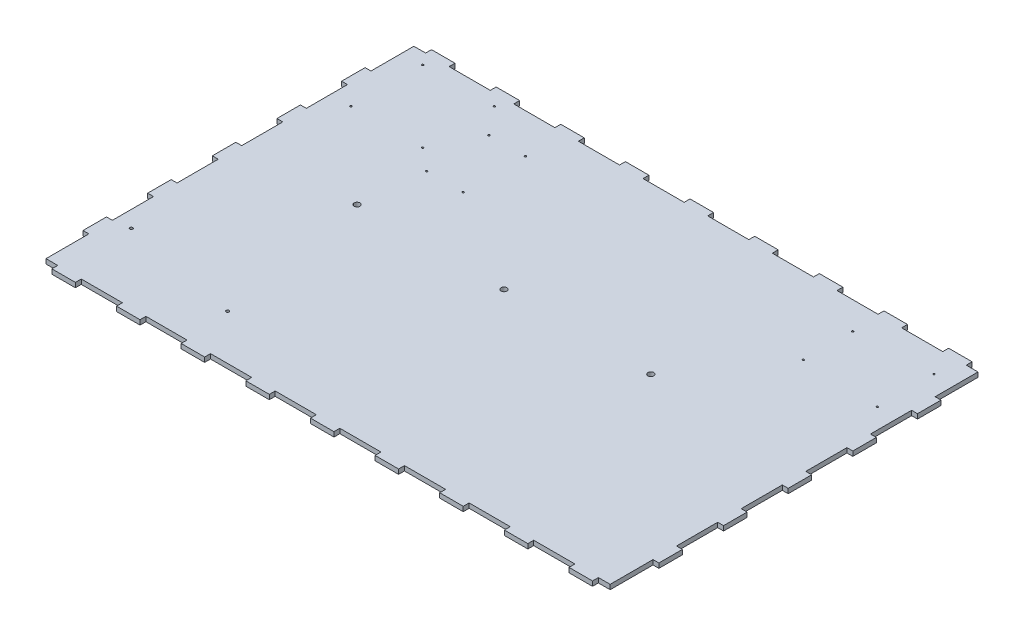
from build123d import *

# Parameters (mm, degrees)
SKETCH1_W                        = 480
SKETCH1_H                        = 313
BASE_DEPTH                       = 4
SKETCH2_W                        = 20
SKETCH2_H                        = 5
TOP_TABS_DEFINITION_DEPTH        = 4
TOP_TABS_PATTERN_COUNT           = 5
TOP_TABS_PATTERN_PITCH           = 55
TOP_TABS_PATTERN_COL_COUNT       = 5
TOP_TABS_PATTERN_COL_PITCH       = 55
BOTTOM_TABS_COPY_1_SKETCH_W      = 20
BOTTOM_TABS_COPY_1_SKETCH_H      = 5
BOTTOM_TABS_COPY_1_DEPTH         = 4
BOTTOM_TABS_COPY_2_SKETCH_W      = 20
BOTTOM_TABS_COPY_2_SKETCH_H      = 5
BOTTOM_TABS_COPY_2_DEPTH         = 4
BOTTOM_TABS_COPY_3_SKETCH_W      = 20
BOTTOM_TABS_COPY_3_SKETCH_H      = 5
BOTTOM_TABS_COPY_3_DEPTH         = 4
BOTTOM_TABS_COPY_4_SKETCH_W      = 20
BOTTOM_TABS_COPY_4_SKETCH_H      = 5
BOTTOM_TABS_COPY_4_DEPTH         = 4
BOTTOM_TABS_COPY_5_SKETCH_W      = 20
BOTTOM_TABS_COPY_5_SKETCH_H      = 5
BOTTOM_TABS_COPY_5_DEPTH         = 4
BOTTOM_TABS_COPY_6_SKETCH_W      = 20
BOTTOM_TABS_COPY_6_SKETCH_H      = 5
BOTTOM_TABS_COPY_6_DEPTH         = 4
BOTTOM_TABS_COPY_7_SKETCH_W      = 20
BOTTOM_TABS_COPY_7_SKETCH_H      = 5
BOTTOM_TABS_COPY_7_DEPTH         = 4
BOTTOM_TABS_COPY_8_SKETCH_W      = 20
BOTTOM_TABS_COPY_8_SKETCH_H      = 5
BOTTOM_TABS_COPY_8_DEPTH         = 4
ELECTRONICS_MOUNTING_HOLES_1_5_D = 1.5
SKETCH7_W                        = 5
SKETCH7_H                        = 20
LEFT_TABS_DEFINITION_DEPTH       = 4
LEFT_TABS_PATTERN_COUNT          = 3
LEFT_TABS_PATTERN_PITCH          = 55
LEFT_TABS_PATTERN_COL_COUNT      = 3
LEFT_TABS_PATTERN_COL_PITCH      = 55
RIGHT_TABS_COPY_1_SKETCH_W       = 5
RIGHT_TABS_COPY_1_SKETCH_H       = 20
RIGHT_TABS_COPY_1_DEPTH          = 4
RIGHT_TABS_COPY_2_SKETCH_W       = 5
RIGHT_TABS_COPY_2_SKETCH_H       = 20
RIGHT_TABS_COPY_2_DEPTH          = 4
RIGHT_TABS_COPY_3_SKETCH_W       = 5
RIGHT_TABS_COPY_3_SKETCH_H       = 20
RIGHT_TABS_COPY_3_DEPTH          = 4
RIGHT_TABS_COPY_4_SKETCH_W       = 5
RIGHT_TABS_COPY_4_SKETCH_H       = 20
RIGHT_TABS_COPY_4_DEPTH          = 4
M6_CLEARANCE_HOLE1_D             = 5
TAP_DRILL_FOR_M3X0_5_TAP1_D      = 2.5


with BuildPart() as part:
    # Sketch1 → Base (new body)
    with BuildSketch(Plane(origin=(0, 0, 0), x_dir=(1, 0, 0), z_dir=(0, 1, 0))):
        Rectangle(SKETCH1_W, SKETCH1_H)
    extrude(amount=BASE_DEPTH)

    # Sketch2 → Top Tabs Definition (add)
    with BuildSketch(Plane(origin=(0, 4, 0), x_dir=(1, 0, 0), z_dir=(0, 1, 0))):
        with Locations((0, 159)):
            Rectangle(SKETCH2_W, SKETCH2_H)
    top_tabs_definition = extrude(amount=-TOP_TABS_DEFINITION_DEPTH)

    # Top Tabs Pattern: Top Tabs Definition ×5
    with Locations(*[(-i * TOP_TABS_PATTERN_PITCH, 0, 0) for i in range(1, TOP_TABS_PATTERN_COUNT)]):
        add(top_tabs_definition)

    # Top Tabs Pattern col: Top Tabs Definition ×5
    with Locations(*[(i * TOP_TABS_PATTERN_COL_PITCH, 0, 0) for i in range(1, TOP_TABS_PATTERN_COL_COUNT)]):
        add(top_tabs_definition)

    # Bottom Tabs: Top Tabs Definition across plane
    add(top_tabs_definition.mirror(Plane.XY))

    # Bottom Tabs copy 1 sketch → Bottom Tabs copy 1 (add)
    with BuildSketch(Plane(origin=(-55, 4, 0), x_dir=(1, 0, 0), z_dir=(0, 1, 0))):
        with Locations((0, -159)):
            Rectangle(BOTTOM_TABS_COPY_1_SKETCH_W, BOTTOM_TABS_COPY_1_SKETCH_H)
    extrude(amount=-BOTTOM_TABS_COPY_1_DEPTH)

    # Bottom Tabs copy 2 sketch → Bottom Tabs copy 2 (add)
    with BuildSketch(Plane(origin=(-110, 4, 0), x_dir=(1, 0, 0), z_dir=(0, 1, 0))):
        with Locations((0, -159)):
            Rectangle(BOTTOM_TABS_COPY_2_SKETCH_W, BOTTOM_TABS_COPY_2_SKETCH_H)
    extrude(amount=-BOTTOM_TABS_COPY_2_DEPTH)

    # Bottom Tabs copy 3 sketch → Bottom Tabs copy 3 (add)
    with BuildSketch(Plane(origin=(-165, 4, 0), x_dir=(1, 0, 0), z_dir=(0, 1, 0))):
        with Locations((0, -159)):
            Rectangle(BOTTOM_TABS_COPY_3_SKETCH_W, BOTTOM_TABS_COPY_3_SKETCH_H)
    extrude(amount=-BOTTOM_TABS_COPY_3_DEPTH)

    # Bottom Tabs copy 4 sketch → Bottom Tabs copy 4 (add)
    with BuildSketch(Plane(origin=(-220, 4, 0), x_dir=(1, 0, 0), z_dir=(0, 1, 0))):
        with Locations((0, -159)):
            Rectangle(BOTTOM_TABS_COPY_4_SKETCH_W, BOTTOM_TABS_COPY_4_SKETCH_H)
    extrude(amount=-BOTTOM_TABS_COPY_4_DEPTH)

    # Bottom Tabs copy 5 sketch → Bottom Tabs copy 5 (add)
    with BuildSketch(Plane(origin=(55, 4, 0), x_dir=(1, 0, 0), z_dir=(0, 1, 0))):
        with Locations((0, -159)):
            Rectangle(BOTTOM_TABS_COPY_5_SKETCH_W, BOTTOM_TABS_COPY_5_SKETCH_H)
    extrude(amount=-BOTTOM_TABS_COPY_5_DEPTH)

    # Bottom Tabs copy 6 sketch → Bottom Tabs copy 6 (add)
    with BuildSketch(Plane(origin=(110, 4, 0), x_dir=(1, 0, 0), z_dir=(0, 1, 0))):
        with Locations((0, -159)):
            Rectangle(BOTTOM_TABS_COPY_6_SKETCH_W, BOTTOM_TABS_COPY_6_SKETCH_H)
    extrude(amount=-BOTTOM_TABS_COPY_6_DEPTH)

    # Bottom Tabs copy 7 sketch → Bottom Tabs copy 7 (add)
    with BuildSketch(Plane(origin=(165, 4, 0), x_dir=(1, 0, 0), z_dir=(0, 1, 0))):
        with Locations((0, -159)):
            Rectangle(BOTTOM_TABS_COPY_7_SKETCH_W, BOTTOM_TABS_COPY_7_SKETCH_H)
    extrude(amount=-BOTTOM_TABS_COPY_7_DEPTH)

    # Bottom Tabs copy 8 sketch → Bottom Tabs copy 8 (add)
    with BuildSketch(Plane(origin=(220, 4, 0), x_dir=(1, 0, 0), z_dir=(0, 1, 0))):
        with Locations((0, -159)):
            Rectangle(BOTTOM_TABS_COPY_8_SKETCH_W, BOTTOM_TABS_COPY_8_SKETCH_H)
    extrude(amount=-BOTTOM_TABS_COPY_8_DEPTH)

    # Electronics Mounting Holes (1.5) (through all)
    with Locations(Plane(origin=(0, 4, 0), x_dir=(1, 0, 0), z_dir=(0, 1, 0))):
        with Locations((-142.5, 122.880889181), (-111.5, 122.880889181), (-111.5, 69.880889181), (-142.5, 69.880889181), (-161.5, 85.493748074), (-161.5, 146.493748074), (-222.5, 146.493748074), (-222.5, 85.493748074), (156.815, 133.05999982), (222.855, 136.23499982), (222.855, 87.97499982), (156.815, 91.14999982)):
            Hole(ELECTRONICS_MOUNTING_HOLES_1_5_D / 2)

    # Sketch7 → Left Tabs Definition (add)
    with BuildSketch(Plane(origin=(0, 4, 0), x_dir=(1, 0, 0), z_dir=(0, 1, 0))):
        with Locations((-242.5, 0)):
            Rectangle(SKETCH7_W, SKETCH7_H)
    left_tabs_definition = extrude(amount=-LEFT_TABS_DEFINITION_DEPTH)

    # Left Tabs Pattern: Left Tabs Definition ×3
    with Locations(*[(0, 0, -i * LEFT_TABS_PATTERN_PITCH) for i in range(1, LEFT_TABS_PATTERN_COUNT)]):
        add(left_tabs_definition)

    # Left Tabs Pattern col: Left Tabs Definition ×3
    with Locations(*[(0, 0, i * LEFT_TABS_PATTERN_COL_PITCH) for i in range(1, LEFT_TABS_PATTERN_COL_COUNT)]):
        add(left_tabs_definition)

    # Right Tabs: Left Tabs Definition across plane
    add(left_tabs_definition.mirror(Plane(origin=(0, 0, 0), x_dir=(0, 0, 1), z_dir=(1, 0, 0))))

    # Right Tabs copy 1 sketch → Right Tabs copy 1 (add)
    with BuildSketch(Plane(origin=(0, 4, -55), x_dir=(-1, 0, 0), z_dir=(0, 1, 0))):
        with Locations((-242.5, 0)):
            Rectangle(RIGHT_TABS_COPY_1_SKETCH_W, RIGHT_TABS_COPY_1_SKETCH_H)
    extrude(amount=-RIGHT_TABS_COPY_1_DEPTH)

    # Right Tabs copy 2 sketch → Right Tabs copy 2 (add)
    with BuildSketch(Plane(origin=(0, 4, -110), x_dir=(-1, 0, 0), z_dir=(0, 1, 0))):
        with Locations((-242.5, 0)):
            Rectangle(RIGHT_TABS_COPY_2_SKETCH_W, RIGHT_TABS_COPY_2_SKETCH_H)
    extrude(amount=-RIGHT_TABS_COPY_2_DEPTH)

    # Right Tabs copy 3 sketch → Right Tabs copy 3 (add)
    with BuildSketch(Plane(origin=(0, 4, 55), x_dir=(-1, 0, 0), z_dir=(0, 1, 0))):
        with Locations((-242.5, 0)):
            Rectangle(RIGHT_TABS_COPY_3_SKETCH_W, RIGHT_TABS_COPY_3_SKETCH_H)
    extrude(amount=-RIGHT_TABS_COPY_3_DEPTH)

    # Right Tabs copy 4 sketch → Right Tabs copy 4 (add)
    with BuildSketch(Plane(origin=(0, 4, 110), x_dir=(-1, 0, 0), z_dir=(0, 1, 0))):
        with Locations((-242.5, 0)):
            Rectangle(RIGHT_TABS_COPY_4_SKETCH_W, RIGHT_TABS_COPY_4_SKETCH_H)
    extrude(amount=-RIGHT_TABS_COPY_4_DEPTH)

    # M6 Clearance Hole1 (through all)
    with Locations(Plane(origin=(0, 4, 0), x_dir=(1, 0, 0), z_dir=(0, 1, 0))):
        with Locations((-147.5, 15.670311787), (-22.5, 15.670311787), (102.5, 15.670311787)):
            Hole(M6_CLEARANCE_HOLE1_D / 2)

    # Tap Drill for M3x0.5 Tap1 (through all)
    with Locations(Plane(origin=(0, 0, 0), x_dir=(-1, 0, 0), z_dir=(0, -1, 0))):
        with Locations((124, -117.946251926), (226, -97.946251926)):
            Hole(TAP_DRILL_FOR_M3X0_5_TAP1_D / 2)


solid = part.part
